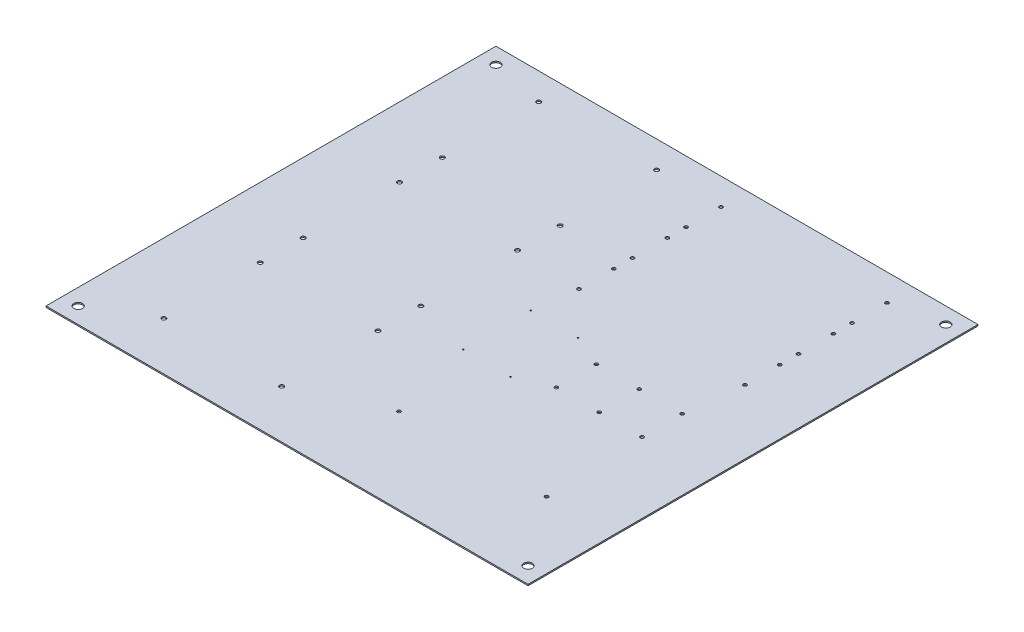
from build123d import *

# Parameters (mm, degrees)
SKETCH1_W               = 571.5
SKETCH1_H               = 533.4
BOSS_EXTRUDE1_DEPTH     = 1.5875
F_10_32_TAPPED_HOLE1_D  = 4.0386
F_1_4_20_TAPPED_HOLE1_D = 5.1054
M2X0_4_TAPPED_HOLE1_D   = 1.6
F_10_32_TAPPED_HOLE2_D  = 4.0386
F_10_32_TAPPED_HOLE3_D  = 4.0386
F_3_8_CLEARANCE_HOLE1_D = 10.31748


with BuildPart() as part:
    # Sketch1 → Boss-Extrude1 (new body)
    with BuildSketch(Plane(origin=(0, 0, 0), x_dir=(1, 0, 0), z_dir=(0, 1, 0))):
        with Locations((285.75, 266.7)):
            Rectangle(SKETCH1_W, SKETCH1_H)
    extrude(amount=BOSS_EXTRUDE1_DEPTH)

    # #10-32 Tapped Hole1 (through all)
    with Locations(Plane(origin=(0, 1.5875, 0), x_dir=(1, 0, 0), z_dir=(0, 1, 0))):
        with Locations((298.45, 501.65), (495.3, 501.65), (298.45, 460.375), (495.3, 460.375), (298.45, 438.15), (495.3, 438.15), (298.45, 396.875), (495.3, 396.875), (298.45, 374.65), (495.3, 374.65), (298.45, 333.375), (495.3, 333.375)):
            Hole(F_10_32_TAPPED_HOLE1_D / 2)

    # 1/4-20 Tapped Hole1 (through all)
    with Locations(Plane(origin=(0, 1.5875, 0), x_dir=(1, 0, 0), z_dir=(0, 1, 0))):
        with Locations((82.55, 501.65), (82.55, 387.35), (222.25, 387.35), (222.25, 501.65), (82.55, 336.55), (82.55, 222.25), (222.25, 222.25), (222.25, 336.55), (82.55, 171.45), (82.55, 57.15), (222.25, 57.15), (222.25, 171.45)):
            Hole(F_1_4_20_TAPPED_HOLE1_D / 2)

    # M2x0.4 Tapped Hole1 (through all)
    with Locations(Plane(origin=(0, 1.5875, 0), x_dir=(1, 0, 0), z_dir=(0, 1, 0))):
        with Locations((292.1, 282.575), (348.09999976, 282.575), (292.1, 202.575), (348.09999976, 202.575)):
            Hole(M2X0_4_TAPPED_HOLE1_D / 2)

    # #10-32 Tapped Hole2 (through all)
    with Locations(Plane(origin=(0, 1.5875, 0), x_dir=(1, 0, 0), z_dir=(0, 1, 0))):
        with Locations((386.19999976, 266.324), (386.19999976, 218.826), (436.99999976, 266.324), (436.99999976, 218.826), (487.79999976, 266.324), (487.79999976, 218.826)):
            Hole(F_10_32_TAPPED_HOLE2_D / 2)

    # #10-32 Tapped Hole3 (through all)
    with Locations(Plane(origin=(0, 1.5875, 0), x_dir=(1, 0, 0), z_dir=(0, 1, 0))):
        with Locations((317.5, 100.975), (492.506, 100.975)):
            Hole(F_10_32_TAPPED_HOLE3_D / 2)

    # 3/8 Clearance Hole1 (through all)
    with Locations(Plane(origin=(0, 1.5875, 0), x_dir=(1, 0, 0), z_dir=(0, 1, 0))):
        with Locations((19.05, 514.35), (552.45, 514.35), (552.45, 19.05), (19.05, 19.05)):
            Hole(F_3_8_CLEARANCE_HOLE1_D / 2)


solid = part.part
